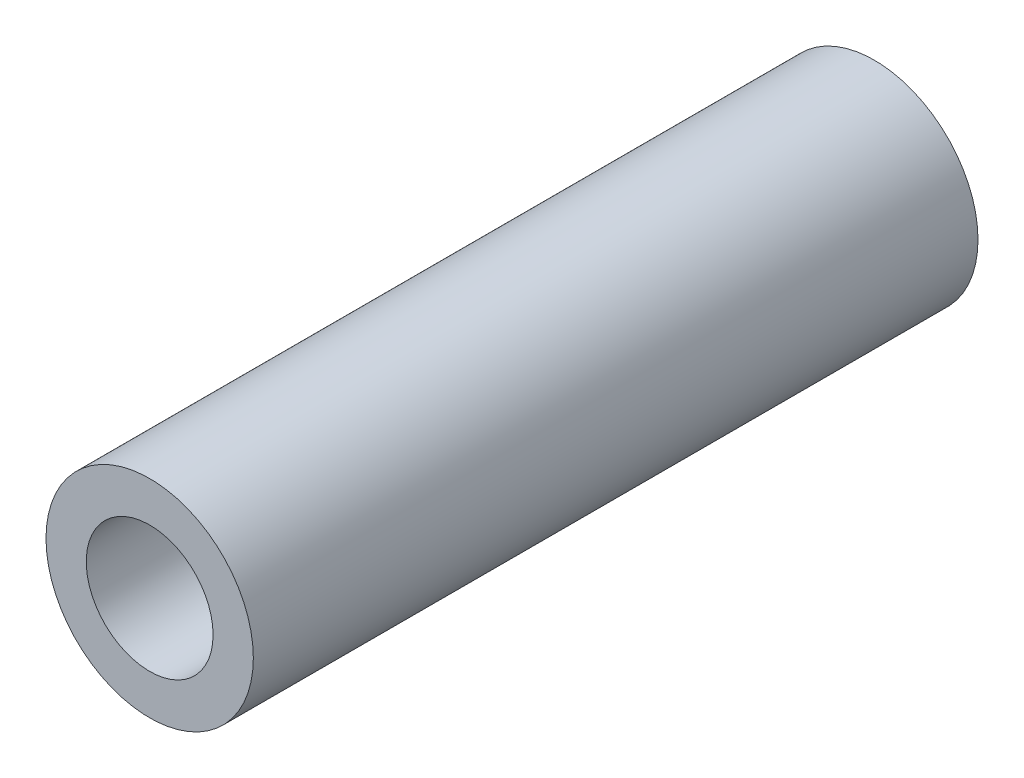
from build123d import *

# Parameters (mm, degrees)
SKETCH1_R           = 2.575
BOSS_EXTRUDE1_DEPTH = 18
CUT_EXTRUDE1_REACH  = 41.953
SKETCH3_R           = 1.575


with BuildPart() as part:
    # Sketch1 → Boss-Extrude1 (new body)
    with BuildSketch(Plane.XY):
        with Locations((33, 0)):
            Circle(SKETCH1_R)
    extrude(amount=BOSS_EXTRUDE1_DEPTH)

    # Sketch3 → Cut-Extrude1 (cut, up to next)
    with BuildSketch(Plane.XY.offset(18), mode=Mode.PRIVATE) as cut_extrude1_sk1:
        with Locations((33, 0)):
            Circle(SKETCH3_R)
    cut_extrude1_tool1 = extrude(cut_extrude1_sk1.sketch, amount=-CUT_EXTRUDE1_REACH, mode=Mode.PRIVATE) & part.part
    add(cut_extrude1_tool1.solids().sort_by_distance((33, 0, 18))[0], mode=Mode.SUBTRACT)


solid = part.part
